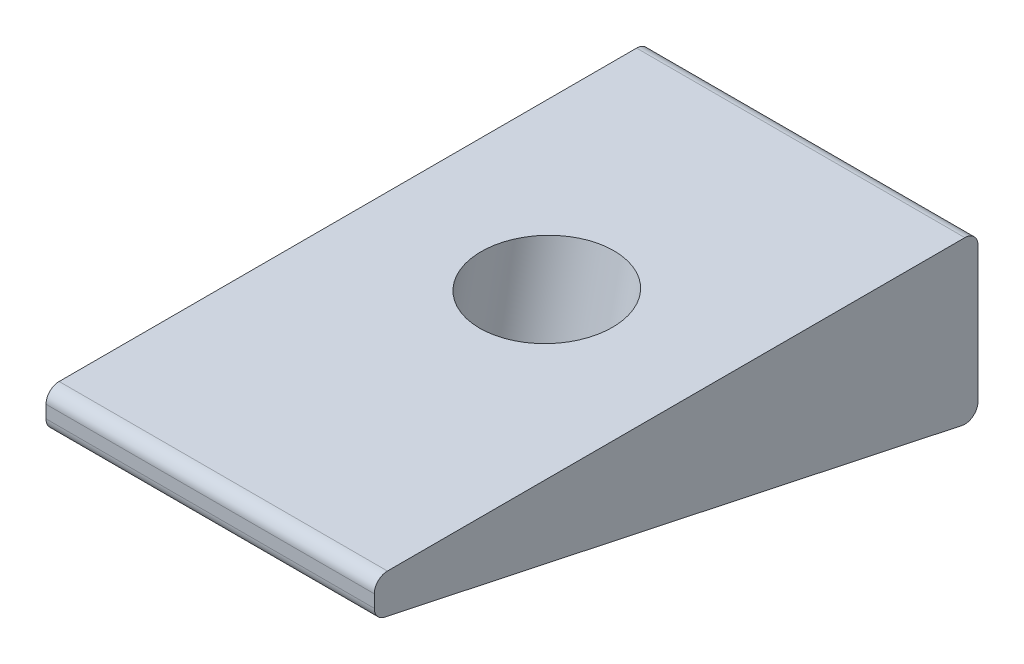
from build123d import *

# Parameters (mm, degrees)
BOSS_EXTRUDE1_DEPTH = 25
SKETCH2_R           = 5
CUT_EXTRUDE1_DEPTH  = 25
SKETCH3_W           = 45.972937234
SKETCH3_H           = 12.458050792
CUT_EXTRUDE2_DEPTH  = 58.995783967
FILLET1_R           = 1


with BuildPart() as part:
    # Sketch1 → Boss-Extrude1 (new body)
    with BuildSketch(Plane(origin=(0, 0, 0), x_dir=(0, 0, -1), z_dir=(1, 0, 0))):
        Polygon((0, 0), (-45.972937234, 0), (-45.972937234, -15.228150532), (0, -25), align=None)
    extrude(amount=BOSS_EXTRUDE1_DEPTH)

    # Sketch2 → Cut-Extrude1 (cut)
    with BuildSketch(Plane(origin=(0, -23.919318221, 5.084208038), x_dir=(1, 0, 0), z_dir=(0, -0.9781476007338064, 0.20791169081775596))):
        with Locations(Location((12.5, 17.30220773, 0), (0, 0, 270))):
            Circle(SKETCH2_R)
    extrude(amount=-CUT_EXTRUDE1_DEPTH, mode=Mode.SUBTRACT)

    # Sketch3 → Cut-Extrude2 (cut, through all)
    with BuildSketch(Plane.ZY):
        with Locations((22.986468617, -6.229025396)):
            Rectangle(SKETCH3_W, SKETCH3_H)
    extrude(amount=-CUT_EXTRUDE2_DEPTH, mode=Mode.SUBTRACT)

    # Fillet1
    fillet1_edges = [part.edges().sort_by_distance(p)[0] for p in [
        (12.5, -12.458050792, 45.972937234),
        (12.5, -12.458050792, 0),
        (12.5, -25, 0),
        (12.5, -15.228150532, 45.972937234),
    ]]
    fillet(fillet1_edges, radius=FILLET1_R)


solid = part.part
